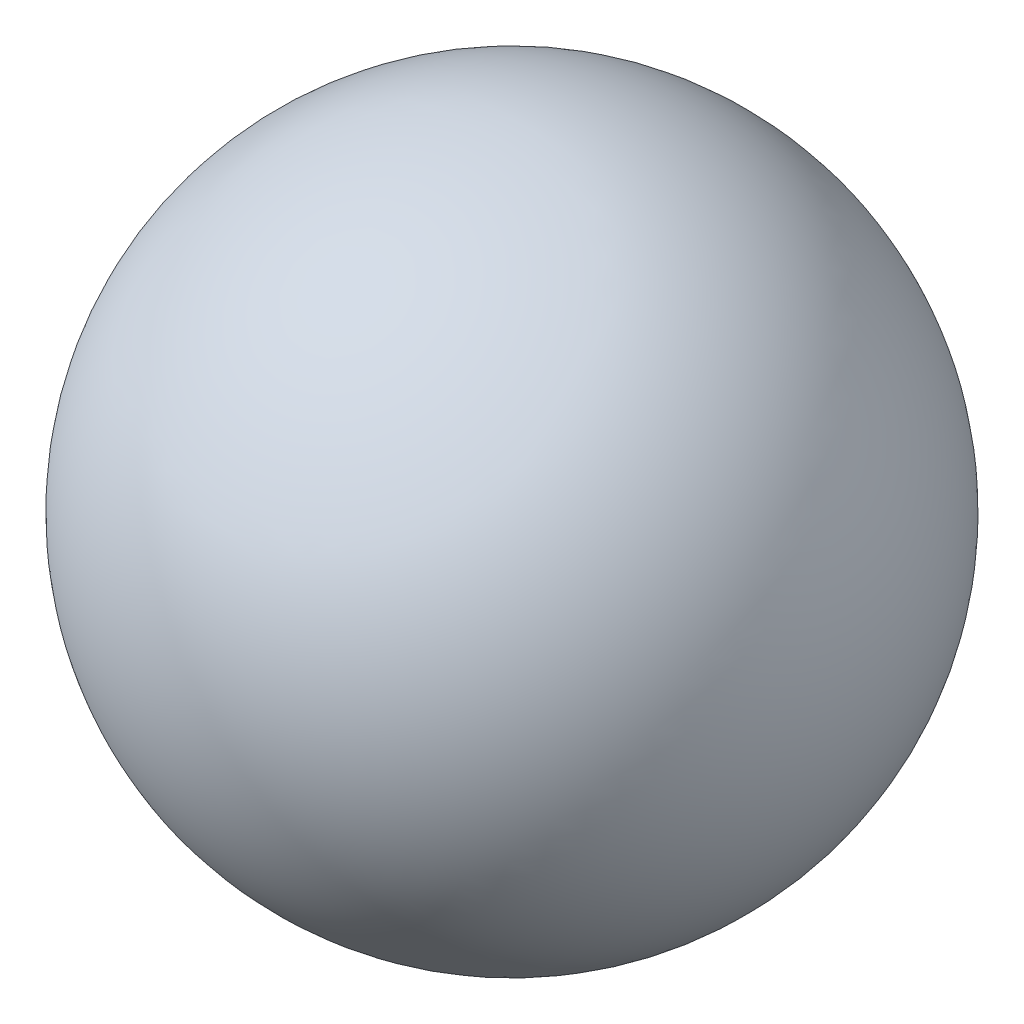
from build123d import *
from build123d.topology import SkipClean


with BuildPart() as part:
    # 草图1 → 旋转2 (revolve)
    with SkipClean():  # the faces are left unmerged after this step: merging them gives an invalid solid
        with BuildSketch(Plane(origin=(0, 0, 0), x_dir=(1, 0, 0), z_dir=(0, 1, 0))):
            with BuildLine():
                ThreePointArc((8.5, 0), (6.01040764, 6.01040764), (0, 8.5))
                Line((0, 8.5), (0, -8.5))
                ThreePointArc((0, -8.5), (6.01040764, -6.01040764), (8.5, 0))
            make_face()
            with BuildLine():
                Line((0, -8.5), (0, 8.5))
                ThreePointArc((0, 8.5), (-8.5, 0), (0, -8.5))
            make_face()
        revolve(axis=Axis((0, 0, -11.038020402), (0, 0, 1)))


solid = part.part
